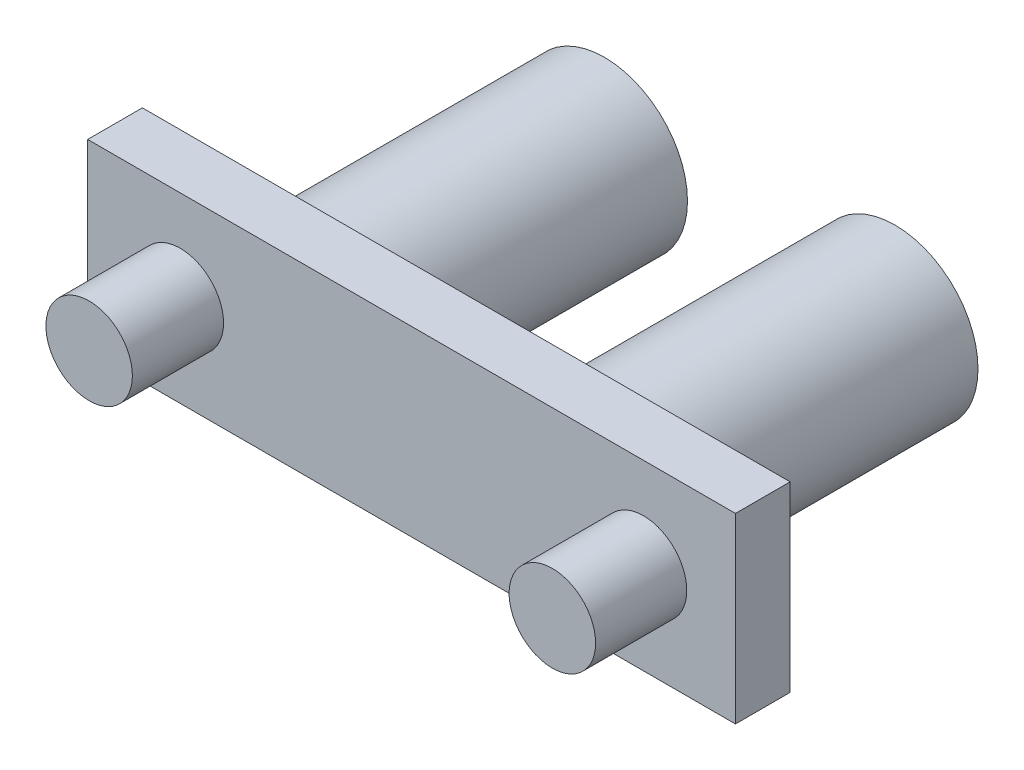
from build123d import *

# Parameters (mm, degrees)
SKETCH1_W           = 17.76
SKETCH1_H           = 5
BOSS_EXTRUDE1_DEPTH = 1.5
SKETCH2_R           = 1.185
BOSS_EXTRUDE2_DEPTH = 2.5
SKETCH3_R           = 2.275
SKETCH3_R_2         = 1.6
SKETCH3_R_3         = 1.601514513
BOSS_EXTRUDE3_DEPTH = 7.76


with BuildPart() as part:
    # Sketch1 → Boss-Extrude1 (new body)
    with BuildSketch(Plane.XY):
        with Locations((8.88, 2.5)):
            Rectangle(SKETCH1_W, SKETCH1_H)
    extrude(amount=BOSS_EXTRUDE1_DEPTH)

    # Sketch2 → Boss-Extrude2 (add)
    with BuildSketch(Plane.XY.offset(1.5)):
        with Locations((2.54, 2.5)):
            Circle(SKETCH2_R)
        with Locations((15.24, 2.5)):
            Circle(SKETCH2_R)
    extrude(amount=BOSS_EXTRUDE2_DEPTH)

    # Sketch3 → Boss-Extrude3 (add)
    # profile 1 of 2: a face of its own
    with BuildSketch(Plane(origin=(0, 0, 0), x_dir=(-1, 0, 0), z_dir=(0, 0, -1))):
        with Locations(Location((-12.875, 2.5, 0), (0, 0, 180))):
            Circle(SKETCH3_R)
        with Locations((-12.875, 2.5)):
            Circle(SKETCH3_R_2, mode=Mode.SUBTRACT)
    # profile 2 of 2: a face of its own
    with BuildSketch(Plane(origin=(0, 0, 0), x_dir=(-1, 0, 0), z_dir=(0, 0, -1))):
        with Locations(Location((-4.91, 2.5, 0), (0, 0, 180))):
            Circle(SKETCH3_R)
        with Locations((-4.91, 2.5)):
            Circle(SKETCH3_R_3, mode=Mode.SUBTRACT)
    extrude(amount=BOSS_EXTRUDE3_DEPTH)


solid = part.part
